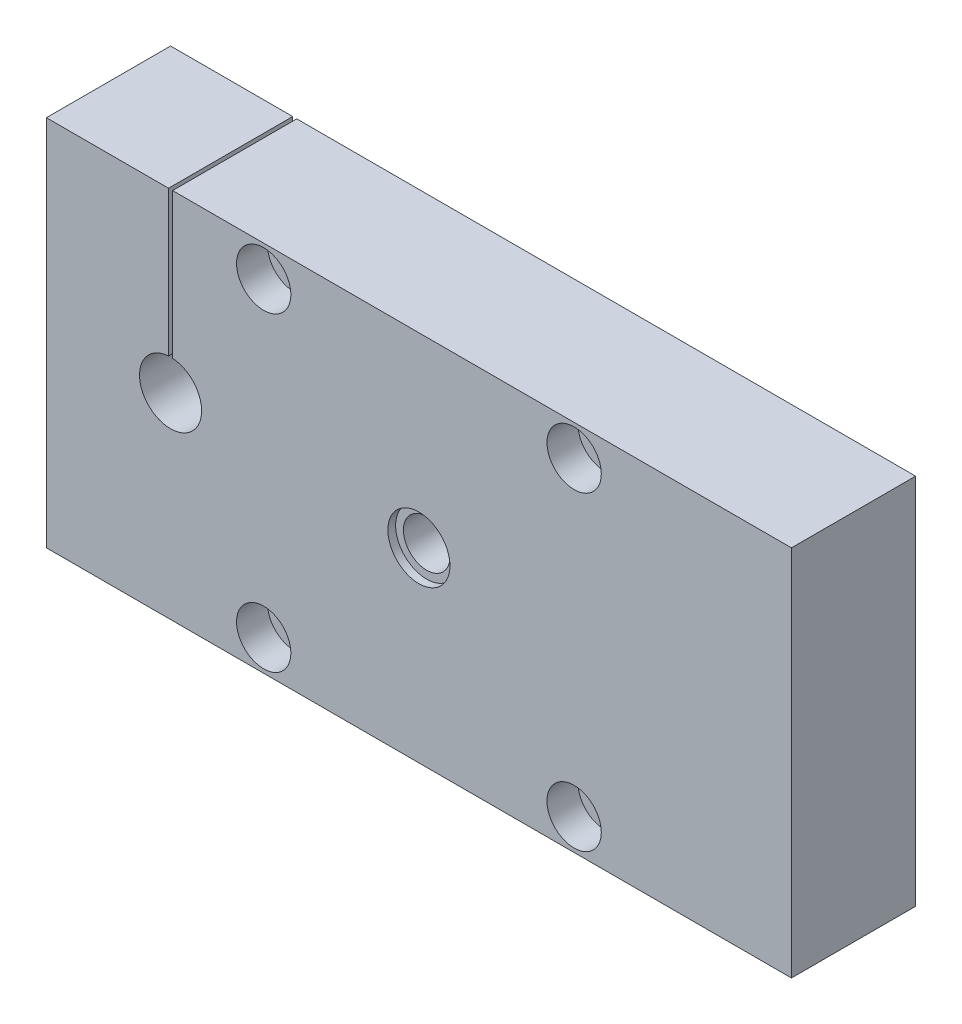
from build123d import *

# Parameters (mm, degrees)
SKETCH1_W                                        = 152.4
SKETCH1_H                                        = 76.2
BOSS_EXTRUDE1_DEPTH                              = 25.4
HOLE1_D                                          = 9.525
HOLE1_CBORE_D                                    = 12.7
HOLE1_CBORE_DEPTH                                = 1.5875
F_1_2_0_5_DIAMETER_HOLE1_D                       = 12.7
CBORE_FOR_1_4_SOCKET_HEAD_CAP_SCREW1_D           = 6.7564
CBORE_FOR_1_4_SOCKET_HEAD_CAP_SCREW1_CBORE_D     = 11.1125
CBORE_FOR_1_4_SOCKET_HEAD_CAP_SCREW1_CBORE_DEPTH = 6.35
CUT_EXTRUDE2_DEPTH                               = 12.7
SKETCH22_W                                       = 0.8255
SKETCH22_H                                       = 29.718728574
CUT_EXTRUDE4_DEPTH                               = 108.010322277


with BuildPart() as part:
    # Sketch1 → Boss-Extrude1 (new body)
    with BuildSketch(Plane.XY):
        with Locations((0.410445336, 32.162996942)):
            Rectangle(SKETCH1_W, SKETCH1_H)
    extrude(amount=BOSS_EXTRUDE1_DEPTH)

    # Hole1 (through all)
    with Locations(Plane.XY.offset(25.4)):
        with Locations((0.410445336, 32.162996942)):
            CounterBoreHole(HOLE1_D / 2, HOLE1_CBORE_D / 2, HOLE1_CBORE_DEPTH)

    # 1/2 (0.5) Diameter Hole1 (through all)
    with Locations(Plane.XY.offset(25.4)):
        with Locations((-50.389554664, 34.207696942)):
            Hole(F_1_2_0_5_DIAMETER_HOLE1_D / 2)

    # CBORE for 1/4 Socket Head Cap Screw1 (through all)
    with Locations(Plane.XY.offset(25.4)):
        with Locations((-31.339554664, 63.912996942), (-31.339554664, 0.412996942), (32.160445336, 0.412996942), (32.160445336, 63.912996942)):
            CounterBoreHole(CBORE_FOR_1_4_SOCKET_HEAD_CAP_SCREW1_D / 2, CBORE_FOR_1_4_SOCKET_HEAD_CAP_SCREW1_CBORE_D / 2, CBORE_FOR_1_4_SOCKET_HEAD_CAP_SCREW1_CBORE_DEPTH)

    # Sketch14 → Cut-Extrude2 (cut)
    with BuildSketch(Plane(origin=(0, 0, 0), x_dir=(-1, 0, 0), z_dir=(0, 0, -1))):
        with BuildLine():
            Line((-13.110445336, 32.162996942), (-13.110445336, -5.937003058))
            Line((-13.110445336, -5.937003058), (12.289554664, -5.937003058))
            Line((12.289554664, -5.937003058), (12.289554664, 32.162996942))
            ThreePointArc((12.289554664, 32.162996942), (-0.410445336, 44.862996942), (-13.110445336, 32.162996942))
        make_face()
    extrude(amount=-CUT_EXTRUDE2_DEPTH, mode=Mode.SUBTRACT)

    # Sketch22 → Cut-Extrude4 (cut, through all)
    with BuildSketch(Plane.XY.offset(25.4)):
        with Locations((-50.389554664, 55.403632655)):
            Rectangle(SKETCH22_W, SKETCH22_H)
    extrude(amount=-CUT_EXTRUDE4_DEPTH, mode=Mode.SUBTRACT)


solid = part.part
